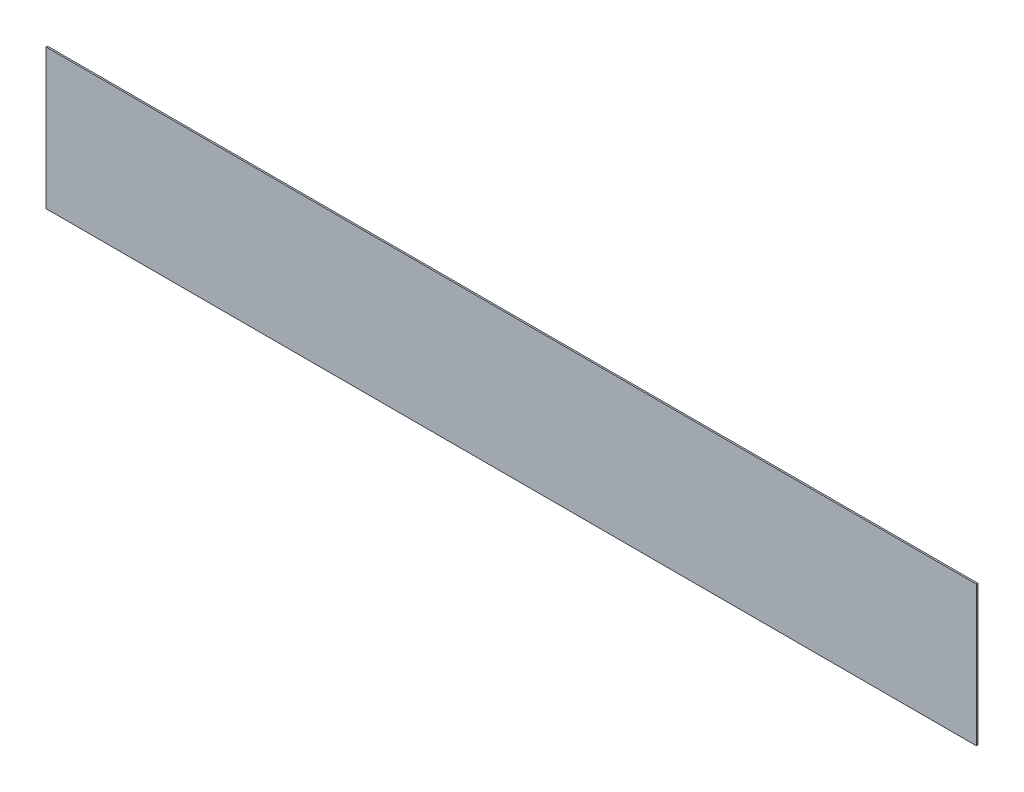
from build123d import *

# Parameters (mm, degrees)
SKETCH1_W                      = 618
SKETCH1_H                      = 93
CEK_TAZE_ON_IC_SAC_1_0_1_DEPTH = 1


with BuildPart() as part:
    # Sketch1 → CEK_taze_on_ic_sac_1.0_1 (new body)
    with BuildSketch(Plane.XY):
        with Locations((309, 46.5)):
            Rectangle(SKETCH1_W, SKETCH1_H)
    extrude(amount=CEK_TAZE_ON_IC_SAC_1_0_1_DEPTH)


solid = part.part
